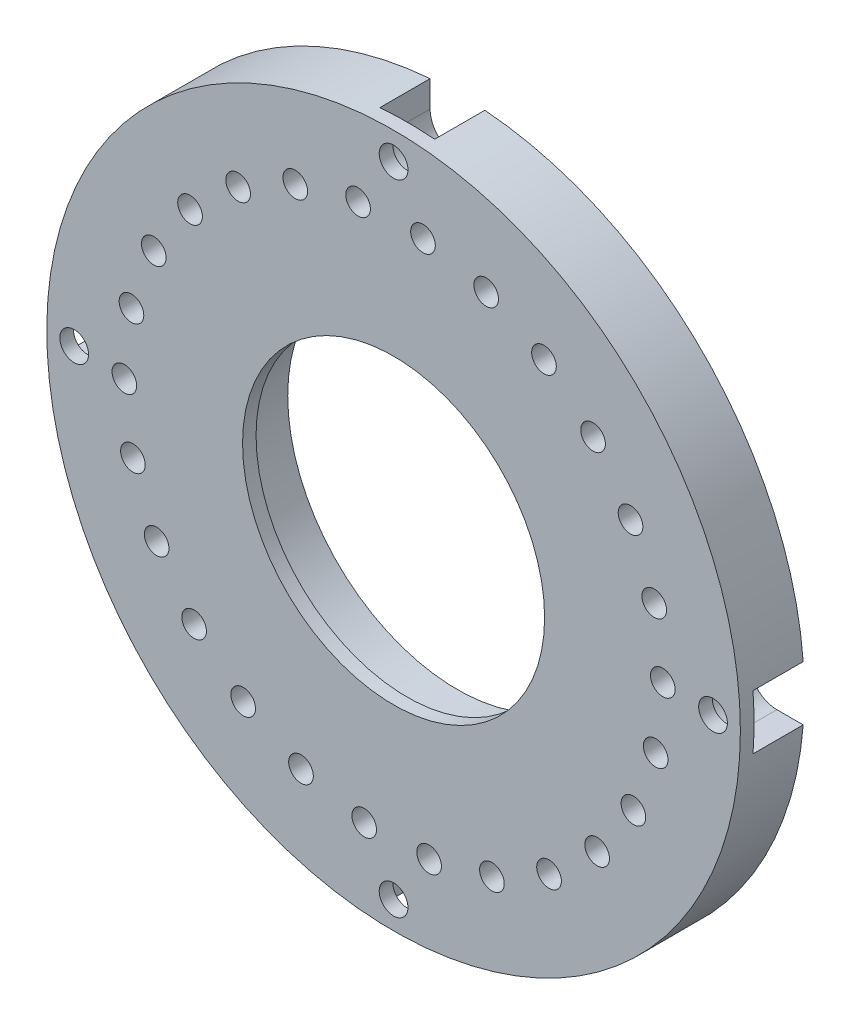
from build123d import *

# Parameters (mm, degrees)
SKETCH1_R           = 48.26
BOSS_EXTRUDE1_DEPTH = 8.89
SKETCH3_R           = 1.7145
CUT_EXTRUDE1_DEPTH  = 3.81
SKETCH4_R           = 21.0185
CUT_EXTRUDE2_DEPTH  = 8.89
CUT_EXTRUDE3_DEPTH  = 99.56230669
BOSS_EXTRUDE2_START = -1.905
SKETCH8_R           = 2
BOSS_EXTRUDE2_DEPTH = 1.905
SKETCH9_R           = 23.622
CUT_EXTRUDE4_DEPTH  = 7.0104


with BuildPart() as part:
    # Sketch1 → Boss-Extrude1 (new body)
    with BuildSketch(Plane.XY):
        with Locations((21.15, -21.15)):
            Circle(SKETCH1_R)
    extrude(amount=BOSS_EXTRUDE1_DEPTH)

    # Sketch3 → Cut-Extrude1 (cut)
    with BuildSketch(Plane.XY.offset(8.89)):
        with Locations((25.240891907, 16.090983183)):
            Circle(SKETCH3_R)
        with Locations((34.034368653, 14.02981338)):
            Circle(SKETCH3_R)
        with Locations((42.079052724, 9.924120696)):
            Circle(SKETCH3_R)
        with Locations((48.907416326, 4.012513068)):
            Circle(SKETCH3_R)
        with Locations((54.122619785, -3.361448357)):
            Circle(SKETCH3_R)
        with Locations((57.421574432, -11.769215746)):
            Circle(SKETCH3_R)
        with Locations((58.612557015, -20.722160217)):
            Circle(SKETCH3_R)
        with Locations((57.626351956, -29.699969182)):
            Circle(SKETCH3_R)
        with Locations((54.520273906, -38.180885015)):
            Circle(SKETCH3_R)
        with Locations((49.474836834, -45.672027717)):
            Circle(SKETCH3_R)
        with Locations((42.783263201, -51.738039301)):
            Circle(SKETCH3_R)
        with Locations((34.834442945, -56.026385224)):
            Circle(SKETCH3_R)
        with Locations((26.090332605, -58.287842408)):
            Circle(SKETCH3_R)
        with Locations((17.059108093, -58.390983183)):
            Circle(SKETCH3_R)
        with Locations((8.265631347, -56.32981338)):
            Circle(SKETCH3_R)
        with Locations((0.220947276, -52.224120696)):
            Circle(SKETCH3_R)
        with Locations((-6.607416326, -46.312513068)):
            Circle(SKETCH3_R)
        with Locations((-11.822619785, -38.938551643)):
            Circle(SKETCH3_R)
        with Locations((-15.121574432, -30.530784254)):
            Circle(SKETCH3_R)
        with Locations((-16.312557015, -21.577839783)):
            Circle(SKETCH3_R)
        with Locations((-15.326351956, -12.600030818)):
            Circle(SKETCH3_R)
        with Locations((-12.220273906, -4.119114985)):
            Circle(SKETCH3_R)
        with Locations((-7.174836834, 3.372027717)):
            Circle(SKETCH3_R)
        with Locations((-0.483263201, 9.438039301)):
            Circle(SKETCH3_R)
        with Locations((7.465557055, 13.726385224)):
            Circle(SKETCH3_R)
        with Locations((16.209667395, 15.987842408)):
            Circle(SKETCH3_R)
    extrude(amount=-CUT_EXTRUDE1_DEPTH, mode=Mode.SUBTRACT)

    # Sketch4 → Cut-Extrude2 (cut)
    with BuildSketch(Plane.XY.offset(8.89)):
        with Locations((21.15, -21.15)):
            Circle(SKETCH4_R)
    extrude(amount=-CUT_EXTRUDE2_DEPTH, mode=Mode.SUBTRACT)

    # Sketch5 → Cut-Extrude3 (cut, through all)
    with BuildSketch(Plane(origin=(0, 0, 0), x_dir=(-1, 0, 0), z_dir=(0, 0, -1))):
        with BuildLine():
            ThreePointArc((-24.96, 23.3), (-21.15, 19.49), (-17.34, 23.3))
            Line((-17.34, 23.3), (-17.34, 26.959370189))
            ThreePointArc((-17.34, 26.959370189), (-21.15, 27.11), (-24.96, 26.959370189))
            Line((-24.96, 26.959370189), (-24.96, 23.3))
        make_face()
        with BuildLine():
            Line((-65.6, -17.34), (-69.259370189, -17.34))
            ThreePointArc((-69.259370189, -17.34), (-69.41, -21.15), (-69.259370189, -24.96))
            Line((-69.259370189, -24.96), (-65.6, -24.96))
            ThreePointArc((-65.6, -24.96), (-61.79, -21.15), (-65.6, -17.34))
        make_face()
        with BuildLine():
            Line((-24.96, -65.6), (-24.96, -69.259370189))
            ThreePointArc((-24.96, -69.259370189), (-21.15, -69.41), (-17.34, -69.259370189))
            Line((-17.34, -69.259370189), (-17.34, -65.6))
            ThreePointArc((-17.34, -65.6), (-21.15, -61.79), (-24.96, -65.6))
        make_face()
        with BuildLine():
            ThreePointArc((27.11, -21.15), (27.072327844, -19.243511779), (26.959370189, -17.34))
            Line((26.959370189, -17.34), (23.3, -17.34))
            ThreePointArc((23.3, -17.34), (19.49, -21.15), (23.3, -24.96))
            Line((23.3, -24.96), (26.959370189, -24.96))
            ThreePointArc((26.959370189, -24.96), (27.072327844, -23.056488221), (27.11, -21.15))
        make_face()
    extrude(amount=-CUT_EXTRUDE3_DEPTH, mode=Mode.SUBTRACT)

    # Sketch8 → Boss-Extrude2 (add)
    # profile 1 of 4: a face of its own
    with BuildSketch(Plane.XY.offset(8.89).offset(BOSS_EXTRUDE2_START)):
        with BuildLine():
            ThreePointArc((-26.959370189, -17.34), (-27.11, -21.15), (-26.959370189, -24.96))
            Line((-26.959370189, -24.96), (-23.3, -24.96))
            ThreePointArc((-23.3, -24.96), (-19.49, -21.15), (-23.3, -17.34))
            Line((-23.3, -17.34), (-26.959370189, -17.34))
        make_face()
        with Locations((-23.3, -21.15)):
            Circle(SKETCH8_R, mode=Mode.SUBTRACT)
    # profile 2 of 4: a face of its own
    with BuildSketch(Plane.XY.offset(8.89).offset(BOSS_EXTRUDE2_START)):
        with BuildLine():
            ThreePointArc((24.96, 26.959370189), (21.15, 27.11), (17.34, 26.959370189))
            Line((17.34, 26.959370189), (17.34, 23.3))
            ThreePointArc((17.34, 23.3), (21.15, 19.49), (24.96, 23.3))
            Line((24.96, 23.3), (24.96, 26.959370189))
        make_face()
        with Locations((21.15, 23.3)):
            Circle(SKETCH8_R, mode=Mode.SUBTRACT)
    # profile 3 of 4: a face of its own
    with BuildSketch(Plane.XY.offset(8.89).offset(BOSS_EXTRUDE2_START)):
        with BuildLine():
            ThreePointArc((69.259370189, -24.96), (69.41, -21.15), (69.259370189, -17.34))
            Line((69.259370189, -17.34), (65.6, -17.34))
            ThreePointArc((65.6, -17.34), (61.79, -21.15), (65.6, -24.96))
            Line((65.6, -24.96), (69.259370189, -24.96))
        make_face()
        with Locations((65.6, -21.15)):
            Circle(SKETCH8_R, mode=Mode.SUBTRACT)
    # profile 4 of 4: a face of its own
    with BuildSketch(Plane.XY.offset(8.89).offset(BOSS_EXTRUDE2_START)):
        with BuildLine():
            ThreePointArc((17.34, -69.259370189), (21.15, -69.41), (24.96, -69.259370189))
            Line((24.96, -69.259370189), (24.96, -65.6))
            ThreePointArc((24.96, -65.6), (21.15, -61.79), (17.34, -65.6))
            Line((17.34, -65.6), (17.34, -69.259370189))
        make_face()
        with Locations((21.15, -65.6)):
            Circle(SKETCH8_R, mode=Mode.SUBTRACT)
    extrude(amount=BOSS_EXTRUDE2_DEPTH)

    # Sketch9 → Cut-Extrude4 (cut)
    with BuildSketch(Plane(origin=(0, 0, 0), x_dir=(-1, 0, 0), z_dir=(0, 0, -1))):
        with Locations((-21.15, -21.15)):
            Circle(SKETCH9_R)
    extrude(amount=-CUT_EXTRUDE4_DEPTH, mode=Mode.SUBTRACT)


solid = part.part
